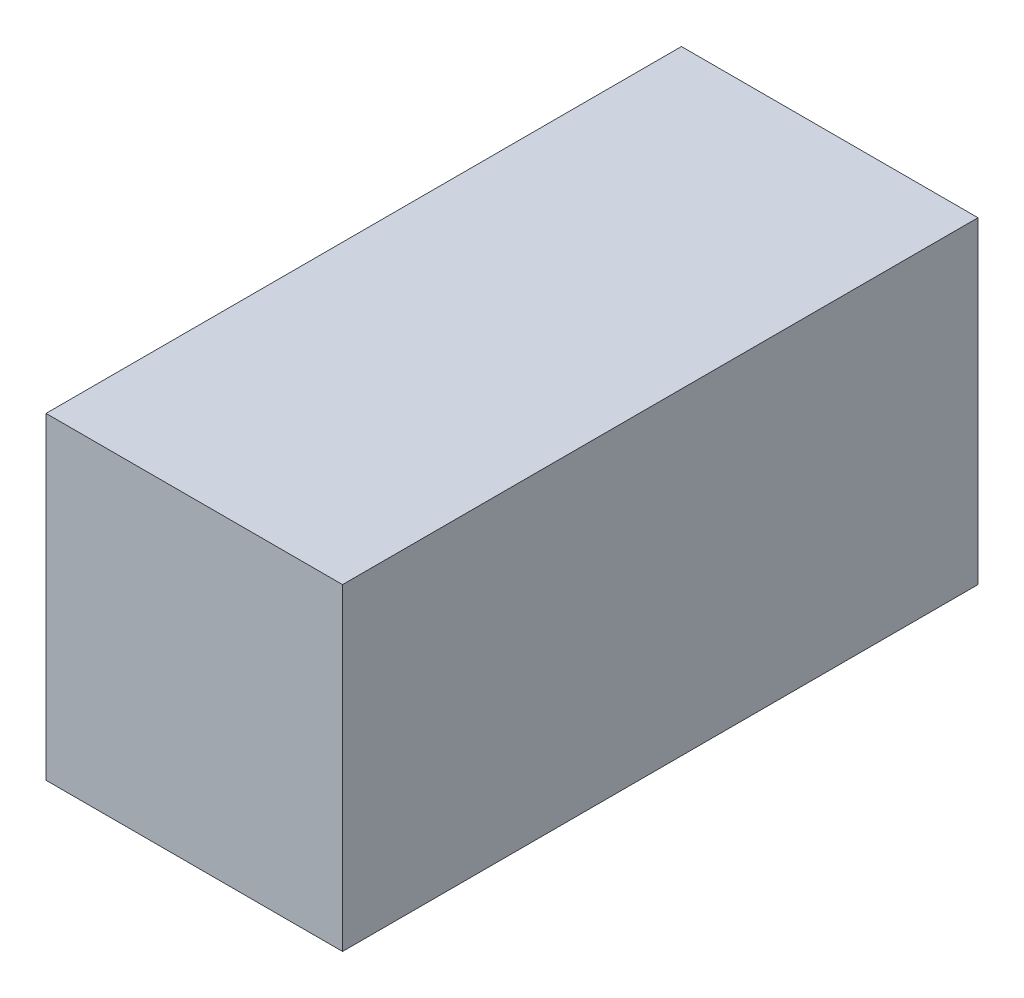
from build123d import *

# Parameters (mm, degrees)
STORE_KLAPE_KASET_KATI_DONMUS_KAP_1_1_START = -100
SKETCH1_W                                   = 140
SKETCH1_H                                   = 150
STORE_KLAPE_KASET_KATI_DONMUS_KAP_1_1_DEPTH = 300


with BuildPart() as part:
    # Sketch1 → STORE_klape_kaset_kati_donmus_kap_1_1 (new body)
    with BuildSketch(Plane.XY.offset(STORE_KLAPE_KASET_KATI_DONMUS_KAP_1_1_START)):
        with Locations((150, 480)):
            Rectangle(SKETCH1_W, SKETCH1_H)
    extrude(amount=-STORE_KLAPE_KASET_KATI_DONMUS_KAP_1_1_DEPTH)


solid = part.part
